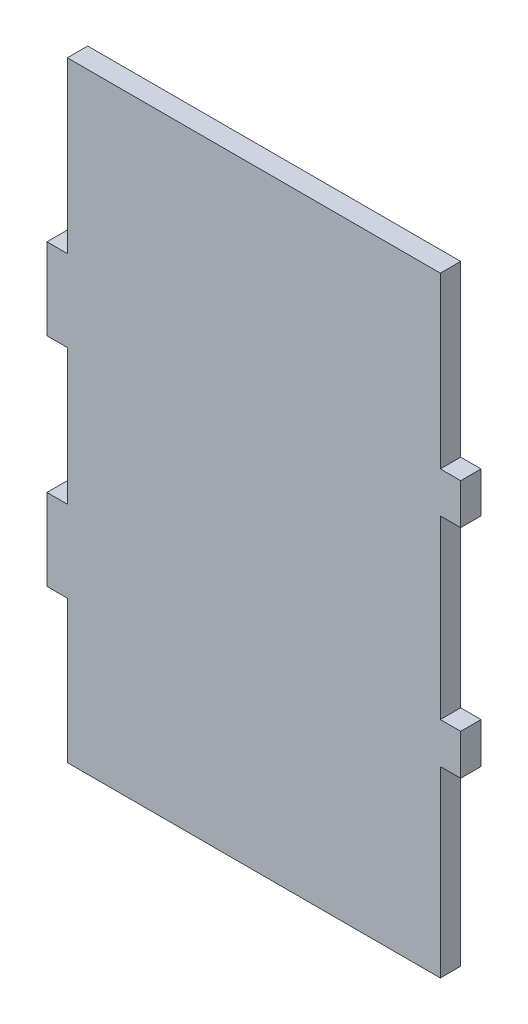
from build123d import *

# Parameters (mm, degrees)
P_IDAT_VYSUNUT_M1_DEPTH = 3


with BuildPart() as part:
    # Skica1 → Přidat vysunutím1 (new body)
    with BuildSketch(Plane.XY):
        Polygon((0, 0), (55, 0), (55, -25), (58, -25), (58, -31), (55, -31), (55, -57), (58, -57), (58, -63), (55, -63), (55, -90), (0, -90), (0, -69), (-3, -69), (-3, -57), (0, -57), (0, -37), (-3, -37), (-3, -25), (0, -25), align=None)
    extrude(amount=P_IDAT_VYSUNUT_M1_DEPTH)


solid = part.part
